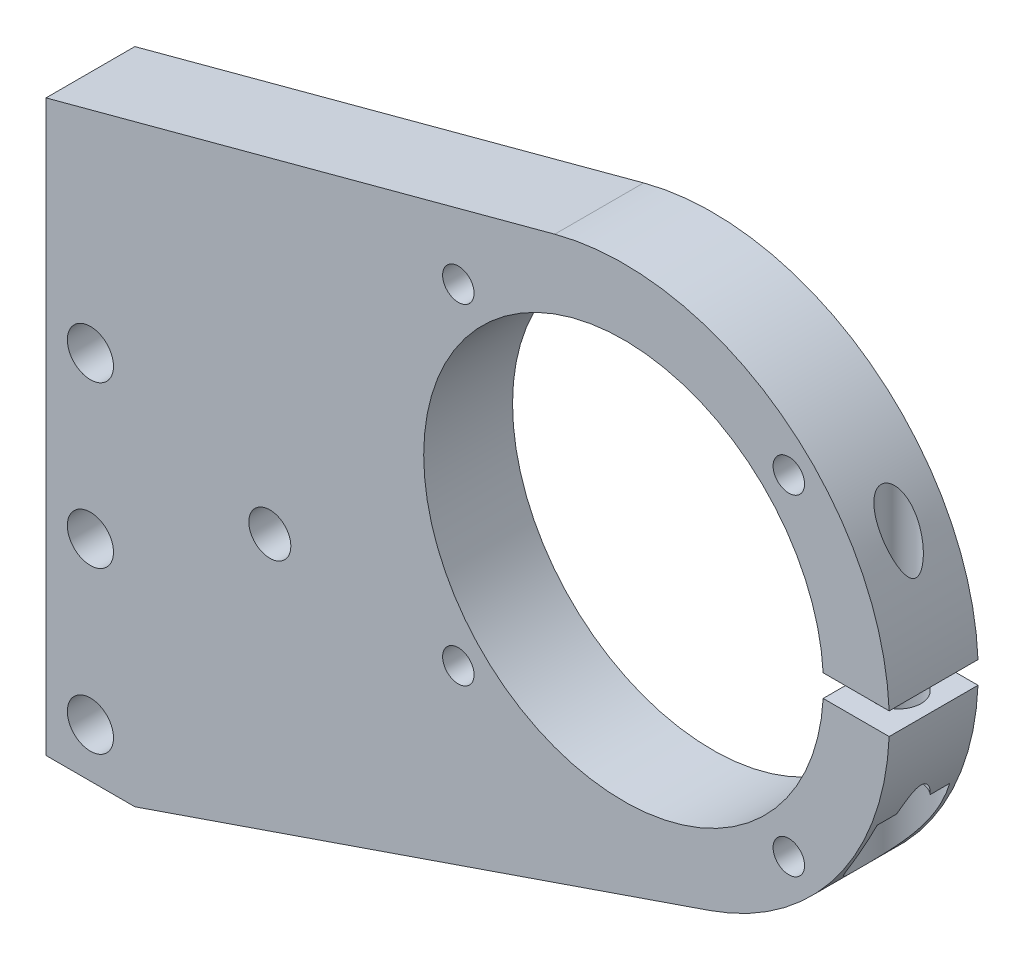
from build123d import *

# Parameters (mm, degrees)
BOSS_EXTRUDE1_DEPTH        = 12.7
CUT_EXTRUDE1_DEPTH         = 270.19769127
SKETCH3_W                  = 28.575
SKETCH3_H                  = 12.7
F_8_CLEARANCE_HOLE1_D      = 4.5
F_1_4_CLEARANCE_HOLE1_D    = 6.6
F_12_CLEARANCE_HOLE1_D     = 6
HOLE1_D                    = 6.4
HOLE1_DEPTH                = 24.77643101
HOLE1_CBORE_D              = 11.2
HOLE1_CBORE_DEPTH          = 11.77643101
F_10_CLEARANCE_HOLE1_D     = 5
F_10_CLEARANCE_HOLE1_DEPTH = 36.4125
CHAMFER1_SIZE              = 3
SKETCH14_R                 = 4
SKETCH14_R_2               = 3
BOSS_EXTRUDE2_DEPTH        = 12.7


with BuildPart() as part:
    # Sketch1 → Boss-Extrude1 (new body)
    with BuildSketch(Plane(origin=(0, 0, 0), x_dir=(-1, 0, 0), z_dir=(0, 0, -1))):
        with BuildLine():
            Line((224.169455465, 127.72254562), (151.435240745, 147.211619716))
            ThreePointArc((151.435240745, 147.211619716), (105.257753851, 121.607458019), (129.246532787, 74.570537656))
            Line((129.246532787, 74.570537656), (211.469455465, 46.304993078))
            Line((211.469455465, 46.304993078), (224.169455465, 46.304993078))
            Line((224.169455465, 46.304993078), (224.169455465, 127.72254562))
        make_face()
    extrude(amount=-BOSS_EXTRUDE1_DEPTH)

    # Sketch2 → Cut-Extrude1 (cut, through all)
    with BuildSketch(Plane.XY.offset(12.7)):
        with BuildLine():
            Line((-103.633291463, 112.093938317), (-113.179018515, 112.093938317))
            ThreePointArc((-113.179018515, 112.093938317), (-113.134717032, 110.506438317), (-113.179018515, 108.918938317))
            Line((-113.179018515, 108.918938317), (-103.633291463, 108.918938317))
            ThreePointArc((-103.633291463, 108.918938317), (-103.600117032, 110.506438317), (-103.633291463, 112.093938317))
        make_face()
    extrude(amount=-CUT_EXTRUDE1_DEPTH, mode=Mode.SUBTRACT)

    # Sketch3 → Cut-Revolve1 (revolve, cut)
    with BuildSketch(Plane(origin=(0, 110.506438317, 0), x_dir=(1, 0, 0), z_dir=(0, 1, 0))):
        with Locations((-127.312617032, -6.35)):
            Rectangle(SKETCH3_W, SKETCH3_H)
    revolve(axis=Axis((-141.600117032, 110.506438317, 0), (0, 0, 1)), mode=Mode.SUBTRACT)

    # #8 Clearance Hole1 (through all)
    with Locations(Plane.XY.offset(12.7)):
        with Locations((-117.978117032, 86.884438317), (-165.222117032, 86.884438317), (-165.222117032, 134.128438317), (-117.978117032, 134.128438317)):
            Hole(F_8_CLEARANCE_HOLE1_D / 2)

    # 1/4 Clearance Hole1 (through all)
    with Locations(Plane(origin=(0, 0, 0), x_dir=(-1, 0, 0), z_dir=(0, 0, -1))):
        with Locations((217.819455465, 53.304993078), (217.819455465, 76.304993078), (217.819455465, 99.304993078)):
            Hole(F_1_4_CLEARANCE_HOLE1_D / 2)

    # #12 Clearance Hole1 (through all)
    with Locations(Plane.XY.offset(12.7)):
        with Locations((-192.169455465, 89.72254562)):
            Hole(F_12_CLEARANCE_HOLE1_D / 2)

    # Hole1
    with Locations(Plane(origin=(0, 84.142507307, 0), x_dir=(-1, 0, 0), z_dir=(0, -1, 0))):
        with Locations((108.633291463, -6.35)):
            CounterBoreHole(HOLE1_D / 2, HOLE1_CBORE_D / 2, HOLE1_CBORE_DEPTH, depth=HOLE1_DEPTH)

    # #10 Clearance Hole1
    with Locations(Plane(origin=(0, 112.093938317, 0), x_dir=(-1, 0, 0), z_dir=(0, -1, 0))):
        with Locations((108.633291463, -6.35)):
            Hole(F_10_CLEARANCE_HOLE1_D / 2, depth=F_10_CLEARANCE_HOLE1_DEPTH)

    # Chamfer1
    chamfer1_edges = [part.edges().sort_by_distance(p)[0] for p in [
        (-221.119455465, 99.304993078, 0),
        (-221.119455465, 76.304993078, 0),
        (-221.119455465, 53.304993078, 0),
    ]]
    chamfer(chamfer1_edges, length=CHAMFER1_SIZE)

    # Sketch14 → Boss-Extrude2 (add)
    with BuildSketch(Plane(origin=(0, 0, 0), x_dir=(-1, 0, 0), z_dir=(0, 0, -1))):
        with Locations((192.169455465, 89.72254562)):
            Circle(SKETCH14_R)
        with Locations(Location((192.169455465, 89.72254562, 0), (0, 0, 180))):
            Circle(SKETCH14_R_2, mode=Mode.SUBTRACT)
    extrude(amount=-BOSS_EXTRUDE2_DEPTH)


solid = part.part
